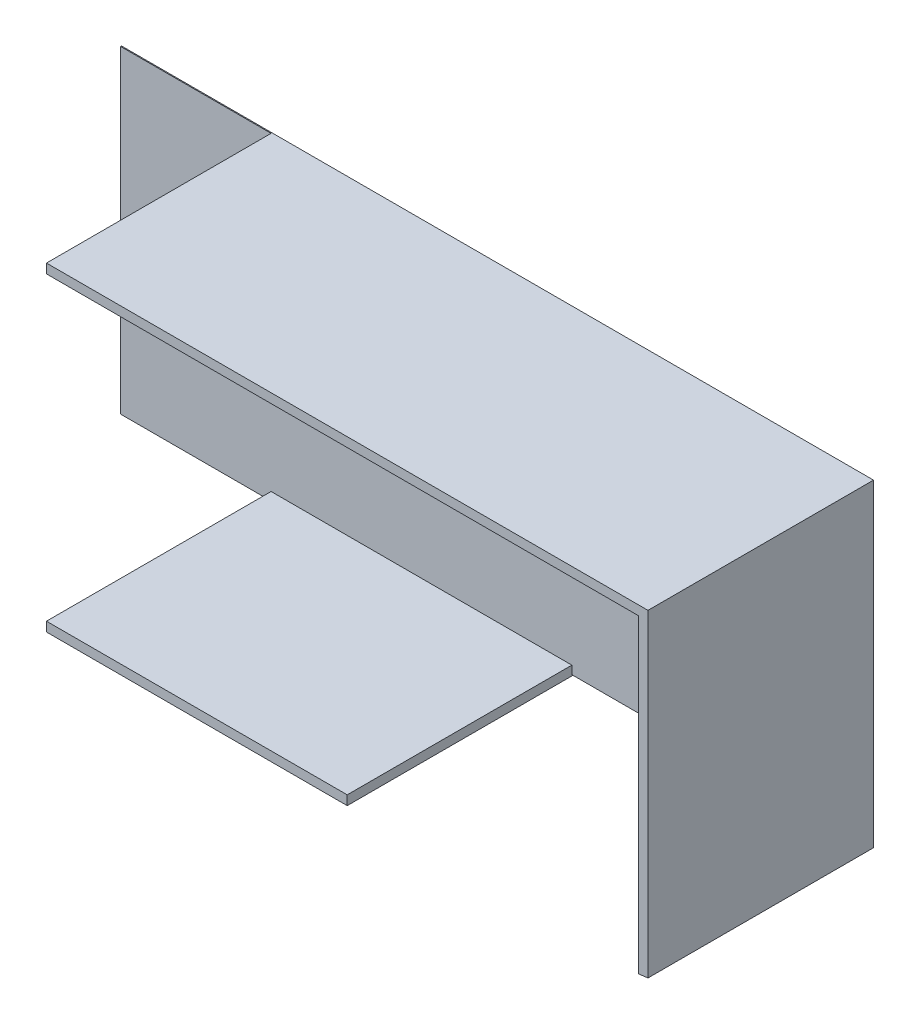
from build123d import *

# Parameters (mm, degrees)
BOSS_EXTRUDE1_DEPTH   = 152.4
SKETCH1_W             = 203.2
SKETCH1_H             = 6.35
BOSS_EXTRUDE1_2_DEPTH = 152.4
SKETCH3_W             = 508
SKETCH3_H             = 215.132857965
BOSS_EXTRUDE2_DEPTH   = 0.635


with BuildPart() as part:
    # Sketch1 → Boss-Extrude1 (new body)
    with BuildSketch(Plane.XY):
        Polygon((400.096509451, -209.55), (406.4, -208.782857965), (406.4, 6.35), (0, 6.35), (0, 0), (400.096509451, 0), align=None)
    extrude(amount=BOSS_EXTRUDE1_DEPTH)



with BuildPart() as body_2:
    # Sketch1 → Boss-Extrude1 2 (new body)
    with BuildSketch(Plane.XY):
        with Locations((101.6, -206.375)):
            Rectangle(SKETCH1_W, SKETCH1_H)
    extrude(amount=BOSS_EXTRUDE1_2_DEPTH)


with BuildPart() as part_1:
    add(part.part)

    add(body_2.part)  # Boss-Extrude2 merges body 2
    # Sketch3 → Boss-Extrude2 (add)
    with BuildSketch(Plane(origin=(0, 0, 0), x_dir=(-1, 0, 0), z_dir=(0, 0, -1))):
        with Locations((-152.4, -101.216428983)):
            Rectangle(SKETCH3_W, SKETCH3_H)
    extrude(amount=-BOSS_EXTRUDE2_DEPTH)


solid = part_1.part
